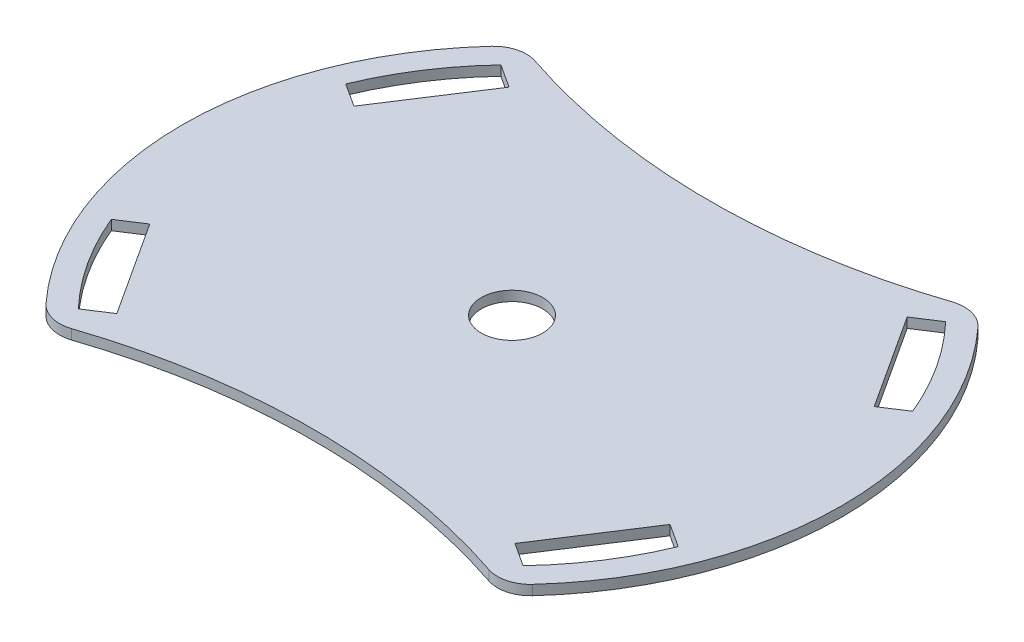
from build123d import *

# Parameters (mm, degrees)
ESBO_O1_R                = 9.327345029
RESSALTO_EXTRUS_O1_DEPTH = 3
CORTE_EXTRUS_O1_DEPTH    = 124.439873489
FILETE1_R                = 10
ESPELHAR2_COPY_1_DEPTH   = 124.439873489


with BuildPart() as part:
    # Esboço1 → Ressalto-extrusão1 (new body)
    with BuildSketch(Plane(origin=(0, 0, 0), x_dir=(1, 0, 0), z_dir=(0, 1, 0))):
        with BuildLine():
            ThreePointArc((69.076751756, -72.307692308), (91.944752911, -39.321271752), (100, 0))
            ThreePointArc((100, 0), (91.944752911, 39.321271752), (69.076751756, 72.307692308))
            ThreePointArc((69.076751756, 72.307692308), (0, 60), (-69.076751756, 72.307692308))
            ThreePointArc((-69.076751756, 72.307692308), (-100, 0), (-69.076751756, -72.307692308))
            ThreePointArc((-69.076751756, -72.307692308), (0, -60), (69.076751756, -72.307692308))
        make_face()
        with Locations(Location((0, 0, 0), (0, 0, 270))):
            Circle(ESBO_O1_R, mode=Mode.SUBTRACT)
    extrude(amount=RESSALTO_EXTRUS_O1_DEPTH)

    # Esboço2 → Corte-extrusão1 (cut, through all)
    with BuildSketch(Plane(origin=(0, 3, 0), x_dir=(1, 0, 0), z_dir=(0, 1, 0))):
        with BuildLine():
            Line((60.350793544, 59.462439561), (78.868520735, 30.947640251))
            Line((78.868520735, 30.947640251), (85.941059495, 35.540600625))
            ThreePointArc((85.941059495, 35.540600625), (82.316182531, 43.278702541), (77.996362885, 50.651430155))
            ThreePointArc((77.996362885, 50.651430155), (73.018069946, 57.596540359), (67.423332305, 64.055399936))
            Line((67.423332305, 64.055399936), (60.350793544, 59.462439561))
        make_face()
    corte_extrus_o1 = extrude(amount=-CORTE_EXTRUS_O1_DEPTH, mode=Mode.SUBTRACT)

    # Filete1
    filete1_edges = [part.edges().sort_by_distance(p)[0] for p in [
        (-69.076751756, 1.5, -72.307692308),
        (69.076751756, 1.5, -72.307692308),
        (69.076751756, 1.5, 72.307692308),
        (-69.076751756, 1.5, 72.307692308),
    ]]
    fillet(filete1_edges, radius=FILETE1_R)

    # Espelhar1: Corte-extrusão1 across plane
    add(corte_extrus_o1.mirror(Plane(origin=(0, 0, 0), x_dir=(0, 0, 1), z_dir=(1, 0, 0))), mode=Mode.SUBTRACT)

    # Espelhar2: Corte-extrusão1 across plane
    add(corte_extrus_o1.mirror(Plane.XY), mode=Mode.SUBTRACT)

    # Espelhar2 copy 1 sketch → Espelhar2 copy 1 (cut, through all)
    with BuildSketch(Plane(origin=(0, 3, 0), x_dir=(-1, 0, 0), z_dir=(0, 1, 0))):
        with BuildLine():
            Line((60.350793544, 59.462439561), (78.868520735, 30.947640251))
            Line((78.868520735, 30.947640251), (85.941059495, 35.540600625))
            ThreePointArc((85.941059495, 35.540600625), (82.316182531, 43.278702541), (77.996362885, 50.651430155))
            ThreePointArc((77.996362885, 50.651430155), (73.018069946, 57.596540359), (67.423332305, 64.055399936))
            Line((67.423332305, 64.055399936), (60.350793544, 59.462439561))
        make_face()
    extrude(amount=-ESPELHAR2_COPY_1_DEPTH, mode=Mode.SUBTRACT)


solid = part.part
